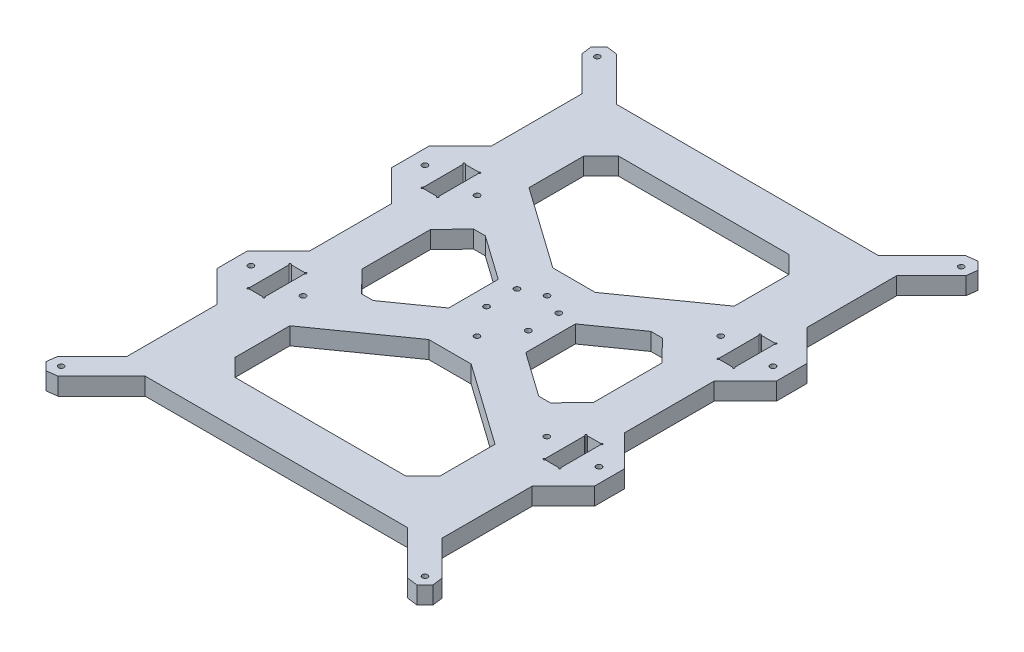
from build123d import *

# Parameters (mm, degrees)
CROQUIS1_R              = 1.6
CROQUIS1_R_2            = 1.55
SALIENTE_EXTRUIR1_DEPTH = 10


with BuildPart() as part:
    # Croquis1 → Saliente-Extruir1 (new body)
    with BuildSketch(Plane(origin=(0, 0, 0), x_dir=(1, 0, 0), z_dir=(0, 1, 0))):
        Polygon((-83.731651282, 156.55753287), (-79.158320061, 161.130864092), (-73.032049507, 160.330757253), (-47.994082864, 135.29279061), (102.792508483, 135.29279061), (127.830475126, 160.330757253), (133.95674568, 161.130864092), (138.530076901, 156.55753287), (137.729970063, 150.431262317), (117.847822253, 130.549114507), (117.847822253, 78.874114811), (127.729970063, 68.991967001), (135.734403375, 60.987533689), (135.734403375, 58.991967001), (135.734403375, 43.56825938), (127.729970063, 35.563826068), (117.847822253, 25.681678258), (117.847822253, -25.681678258), (127.729970063, -35.563826068), (135.734403375, -43.56825938), (135.734403375, -60.987533689), (127.729970063, -68.991967001), (117.847822253, -78.874114811), (117.847822253, -130.549114507), (137.729970063, -150.431262317), (138.530076901, -156.55753287), (133.95674568, -161.130864092), (127.830475126, -160.330757253), (102.792508483, -135.29279061), (-47.994082864, -135.29279061), (-73.032049507, -160.330757253), (-79.158320061, -161.130864092), (-83.731651282, -156.55753287), (-82.931544444, -150.431262317), (-63.049396634, -130.549114507), (-63.049396634, -78.874114811), (-72.931544444, -68.991967001), (-80.934057958, -60.989453487), (-80.934057958, -43.566339582), (-72.931544444, -35.563826068), (-63.049396634, -25.681678258), (-63.049396634, 21.125885189), (-72.931544444, 31.008032999), (-80.934057958, 39.010546513), (-80.934057958, 58.991967001), (-80.934057958, 60.989453487), (-72.931544444, 68.991967001), (-63.049396634, 78.874114811), (-63.049396634, 130.549114507), (-82.931544444, 150.431262317), align=None)
        with Locations(Location((-72.60085541, -50.001190143, 0), (0, 0, 270))):
            Circle(CROQUIS1_R, mode=Mode.SUBTRACT)
        with Locations(Location((-72.60085541, 49.957044921, 0), (0, 0, 270))):
            Circle(CROQUIS1_R, mode=Mode.SUBTRACT)
        with Locations(Location((97.39914459, -50.001195503, 0), (0, 0, 270))):
            Circle(CROQUIS1_R, mode=Mode.SUBTRACT)
        with Locations(Location((-77.10078719, 153.5, 0), (0, 0, 270))):
            Circle(CROQUIS1_R_2, mode=Mode.SUBTRACT)
        with Locations(Location((131.89921281, 153.5, 0), (0, 0, 90))):
            Circle(CROQUIS1_R_2, mode=Mode.SUBTRACT)
        with Locations(Location((97.39914459, 49.957044921, 0), (0, 0, 270))):
            Circle(CROQUIS1_R, mode=Mode.SUBTRACT)
        with Locations(Location((27.39921281, 20.131279802, 0), (0, 0, 270))):
            Circle(CROQUIS1_R_2, mode=Mode.SUBTRACT)
        with Locations(Location((27.399212809, -20.131279802, 0), (0, 0, 90))):
            Circle(CROQUIS1_R_2, mode=Mode.SUBTRACT)
        with Locations(Location((131.89921281, -154.5, 0), (0, 0, 270))):
            Circle(CROQUIS1_R_2, mode=Mode.SUBTRACT)
        with Locations(Location((-77.10078719, -154.5, 0), (0, 0, 90))):
            Circle(CROQUIS1_R_2, mode=Mode.SUBTRACT)
        with Locations(Location((39.39921281, 14.868720198, 0), (0, 0, 270))):
            Circle(CROQUIS1_R, mode=Mode.SUBTRACT)
        with Locations(Location((15.39921281, 14.868720198, 0), (0, 0, 270))):
            Circle(CROQUIS1_R, mode=Mode.SUBTRACT)
        with Locations(Location((39.39921281, -2.631279802, 0), (0, 0, 270))):
            Circle(CROQUIS1_R, mode=Mode.SUBTRACT)
        with Locations(Location((15.39921281, -2.631279802, 0), (0, 0, 270))):
            Circle(CROQUIS1_R, mode=Mode.SUBTRACT)
        with Locations(Location((-42.60085541, 49.957020155, 0), (0, 0, 270))):
            Circle(CROQUIS1_R, mode=Mode.SUBTRACT)
        with Locations(Location((-42.60085541, -50.001214909, 0), (0, 0, 270))):
            Circle(CROQUIS1_R, mode=Mode.SUBTRACT)
        with Locations(Location((127.39914459, 49.957020155, 0), (0, 0, 270))):
            Circle(CROQUIS1_R, mode=Mode.SUBTRACT)
        with Locations(Location((127.39914459, -50.001220269, 0), (0, 0, 270))):
            Circle(CROQUIS1_R, mode=Mode.SUBTRACT)
        Polygon((-39.036453098, 19.62934529), (-39.036453098, -19.62934529), (-26.843918916, -32.22180516), (-20.164597864, -32.22180516), (5.244035613, -14.252996646), (5.244035613, 14.252996646), (-20.164597864, 32.22180516), (-26.843918916, 32.22180516), align=None, mode=Mode.SUBTRACT)
        Polygon((-31.542972252, 100.139969228), (-31.542972252, 68.700211283), (15.217390497, 35.631608635), (39.581035122, 35.631608635), (86.341397871, 68.700211283), (86.341397871, 100.139969228), (76.341397871, 110.139969228), (-21.542972252, 110.139969228), align=None, mode=Mode.SUBTRACT)
        with BuildLine():
            Line((-61.23476769, -37.951196668), (-53.96680669, -37.951199668))
            ThreePointArc((-53.96680669, -37.951199668), (-53.716807383, -37.884213008), (-53.533794646, -37.701201522))
            ThreePointArc((-53.533794646, -37.701201522), (-52.747229229, -37.597651368), (-52.850783941, -38.384216185))
            ThreePointArc((-52.850783941, -38.384216185), (-53.033795864, -38.567227373), (-53.100784037, -38.81722546))
            Line((-53.100784037, -38.81722546), (-53.100802502, -61.18517446))
            ThreePointArc((-53.100802502, -61.18517446), (-53.033815411, -61.435174515), (-52.85080286, -61.618187368))
            ThreePointArc((-52.85080286, -61.618187368), (-52.747249037, -62.404753791), (-53.533815709, -62.301201857))
            ThreePointArc((-53.533815709, -62.301201857), (-53.71682792, -62.118190482), (-53.966826693, -62.051203569))
            Line((-53.966826693, -62.051203569), (-61.234787693, -62.051197537))
            ThreePointArc((-61.234787693, -62.051197537), (-61.484787748, -62.118184628), (-61.667800601, -62.301197179))
            ThreePointArc((-61.667800601, -62.301197179), (-62.454367024, -62.404751002), (-62.35081509, -61.61818433))
            ThreePointArc((-62.35081509, -61.61818433), (-62.167803248, -61.435171927), (-62.100816152, -61.185172721))
            Line((-62.100816152, -61.185172721), (-62.100797686, -38.817219721))
            ThreePointArc((-62.100797686, -38.817219721), (-62.167784346, -38.567220414), (-62.350795832, -38.384207677))
            ThreePointArc((-62.350795832, -38.384207677), (-62.454345986, -37.59764226), (-61.667781169, -37.701196972))
            ThreePointArc((-61.667781169, -37.701196972), (-61.484768059, -37.884209661), (-61.23476769, -37.951196668))
        make_face(mode=Mode.SUBTRACT)
        with BuildLine():
            Line((108.76523231, -37.951202028), (116.03319331, -37.951205028))
            ThreePointArc((116.03319331, -37.951205028), (116.283192617, -37.884218369), (116.466205354, -37.701206882))
            ThreePointArc((116.466205354, -37.701206882), (117.252770771, -37.597656728), (117.149216059, -38.384221545))
            ThreePointArc((117.149216059, -38.384221545), (116.966204136, -38.567232733), (116.899215963, -38.81723082))
            Line((116.899215963, -38.81723082), (116.899197498, -61.18517982))
            ThreePointArc((116.899197498, -61.18517982), (116.966184589, -61.435179876), (117.14919714, -61.618192729))
            ThreePointArc((117.14919714, -61.618192729), (117.252750963, -62.404759152), (116.466184291, -62.301207218))
            ThreePointArc((116.466184291, -62.301207218), (116.28317208, -62.118195842), (116.033173307, -62.051208929))
            Line((116.033173307, -62.051208929), (108.765212307, -62.051202897))
            ThreePointArc((108.765212307, -62.051202897), (108.515212252, -62.118189989), (108.332199399, -62.301202539))
            ThreePointArc((108.332199399, -62.301202539), (107.545632976, -62.404756362), (107.64918491, -61.61818969))
            ThreePointArc((107.64918491, -61.61818969), (107.832196752, -61.435177287), (107.899183848, -61.185178081))
            Line((107.899183848, -61.185178081), (107.899202314, -38.817225081))
            ThreePointArc((107.899202314, -38.817225081), (107.832215654, -38.567225774), (107.649204168, -38.384213037))
            ThreePointArc((107.649204168, -38.384213037), (107.545654014, -37.59764762), (108.332218831, -37.701202332))
            ThreePointArc((108.332218831, -37.701202332), (108.515231941, -37.884215022), (108.76523231, -37.951202028))
        make_face(mode=Mode.SUBTRACT)
        Polygon((74.963023483, 32.22180516), (49.554390006, 14.252996646), (49.554390006, -14.252996646), (74.963023483, -32.22180516), (81.642344535, -32.22180516), (93.834878717, -19.62934529), (93.834878717, 19.62934529), (81.642344535, 32.22180516), align=None, mode=Mode.SUBTRACT)
        with BuildLine():
            Line((108.76523231, 62.007038396), (116.03319331, 62.007035396))
            ThreePointArc((116.03319331, 62.007035396), (116.283192617, 62.074022056), (116.466205354, 62.257033542))
            ThreePointArc((116.466205354, 62.257033542), (117.252770771, 62.360583696), (117.149216059, 61.574018879))
            ThreePointArc((117.149216059, 61.574018879), (116.966204136, 61.391007691), (116.899215963, 61.141009604))
            Line((116.899215963, 61.141009604), (116.899197498, 38.773060604))
            ThreePointArc((116.899197498, 38.773060604), (116.966184589, 38.523060549), (117.14919714, 38.340047696))
            ThreePointArc((117.14919714, 38.340047696), (117.252750963, 37.553481273), (116.466184291, 37.657033207))
            ThreePointArc((116.466184291, 37.657033207), (116.28317208, 37.840044582), (116.033173307, 37.907031495))
            Line((116.033173307, 37.907031495), (108.765212307, 37.907037528))
            ThreePointArc((108.765212307, 37.907037528), (108.515212252, 37.840050436), (108.332199399, 37.657037885))
            ThreePointArc((108.332199399, 37.657037885), (107.545632976, 37.553484062), (107.64918491, 38.340050734))
            ThreePointArc((107.64918491, 38.340050734), (107.832196752, 38.523063137), (107.899183848, 38.773062343))
            Line((107.899183848, 38.773062343), (107.899202314, 61.141015343))
            ThreePointArc((107.899202314, 61.141015343), (107.832215654, 61.39101465), (107.649204168, 61.574027387))
            ThreePointArc((107.649204168, 61.574027387), (107.545654014, 62.360592804), (108.332218831, 62.257038092))
            ThreePointArc((108.332218831, 62.257038092), (108.515231941, 62.074025403), (108.76523231, 62.007038396))
        make_face(mode=Mode.SUBTRACT)
        Polygon((-21.542972252, -110.139969228), (76.341397871, -110.139969228), (86.341397871, -100.139969228), (86.341397871, -68.700211283), (39.581035122, -35.631608635), (15.217390497, -35.631608635), (-31.542972252, -68.700211283), (-31.542972252, -100.139969228), align=None, mode=Mode.SUBTRACT)
        with BuildLine():
            Line((-61.23476769, 62.007038396), (-53.96680669, 62.007035396))
            ThreePointArc((-53.96680669, 62.007035396), (-53.716807383, 62.074022056), (-53.533794646, 62.257033542))
            ThreePointArc((-53.533794646, 62.257033542), (-52.747229229, 62.360583696), (-52.850783941, 61.574018879))
            ThreePointArc((-52.850783941, 61.574018879), (-53.033795864, 61.391007691), (-53.100784037, 61.141009604))
            Line((-53.100784037, 61.141009604), (-53.100802502, 38.773060604))
            ThreePointArc((-53.100802502, 38.773060604), (-53.033815411, 38.523060549), (-52.85080286, 38.340047696))
            ThreePointArc((-52.85080286, 38.340047696), (-52.747249037, 37.553481273), (-53.533815709, 37.657033207))
            ThreePointArc((-53.533815709, 37.657033207), (-53.71682792, 37.840044582), (-53.966826693, 37.907031495))
            Line((-53.966826693, 37.907031495), (-61.234787693, 37.907037528))
            ThreePointArc((-61.234787693, 37.907037528), (-61.484787748, 37.840050436), (-61.667800601, 37.657037885))
            ThreePointArc((-61.667800601, 37.657037885), (-62.454367024, 37.553484062), (-62.35081509, 38.340050734))
            ThreePointArc((-62.35081509, 38.340050734), (-62.167803248, 38.523063137), (-62.100816152, 38.773062343))
            Line((-62.100816152, 38.773062343), (-62.100797686, 61.141015343))
            ThreePointArc((-62.100797686, 61.141015343), (-62.167784346, 61.39101465), (-62.350795832, 61.574027387))
            ThreePointArc((-62.350795832, 61.574027387), (-62.454345986, 62.360592804), (-61.667781169, 62.257038092))
            ThreePointArc((-61.667781169, 62.257038092), (-61.484768059, 62.074025403), (-61.23476769, 62.007038396))
        make_face(mode=Mode.SUBTRACT)
    extrude(amount=SALIENTE_EXTRUIR1_DEPTH)


solid = part.part
